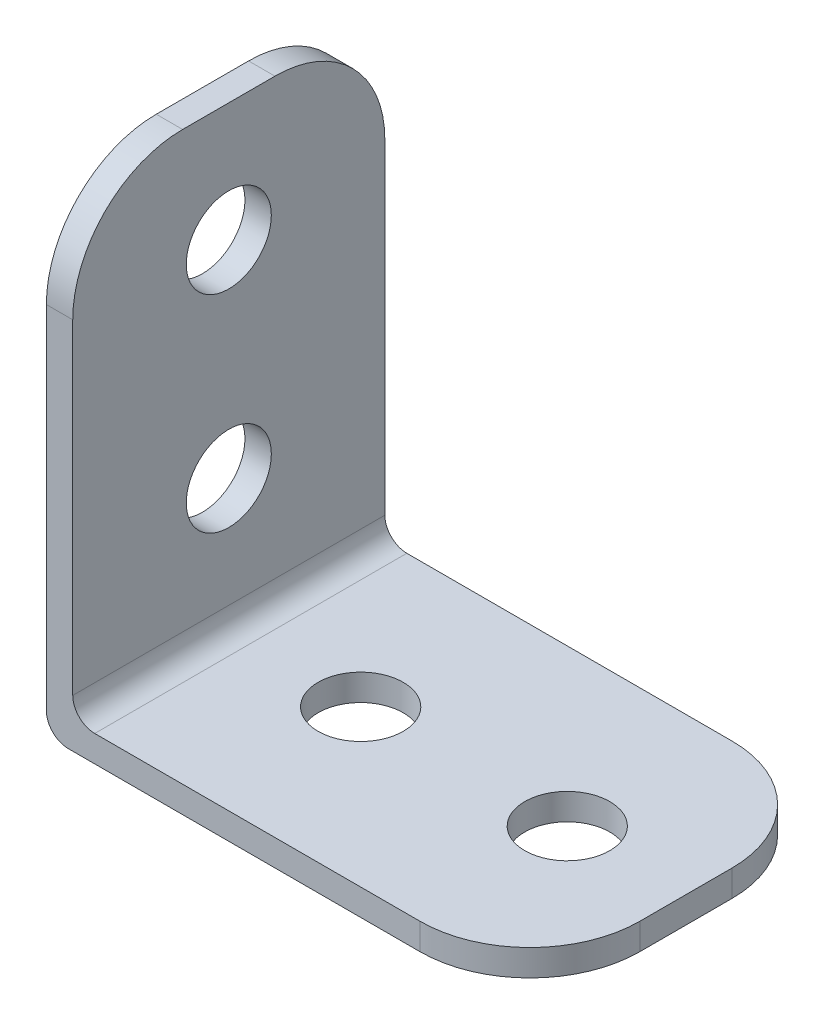
from build123d import *

# Parameters (mm, degrees)
SKETCH1_W                        = 26.416
SKETCH1_H                        = 18.034
BOSS_EXTRUDE2_DEPTH              = 1.524
SKETCH1_4_W                      = 1.524
SKETCH1_4_H                      = 18.034
BOSS_EXTRUDE3_DEPTH              = 27.94
FILLET1_R                        = 1.27
FILLET2_R                        = 6.35
F_10_0_1935_DIAMETER_HOLE1_D     = 4.9149
F_10_0_1935_DIAMETER_HOLE1_DEPTH = 5.08
F_10_0_1935_DIAMETER_HOLE1_TIP   = 1.476584928
F_10_0_1935_DIAMETER_HOLE2_D     = 4.9149
F_10_0_1935_DIAMETER_HOLE2_DEPTH = 5.08
F_10_0_1935_DIAMETER_HOLE2_TIP   = 1.476584928


with BuildPart() as part:
    # Sketch1 → Boss-Extrude2 (new body)
    with BuildSketch(Plane(origin=(0, 0, 0), x_dir=(1, 0, 0), z_dir=(0, 1, 0))):
        with Locations((1.735252818, 0.105208004)):
            Rectangle(SKETCH1_W, SKETCH1_H)
    extrude(amount=BOSS_EXTRUDE2_DEPTH)

    # Sketch1<4> → Boss-Extrude3 (add)
    with BuildSketch(Plane(origin=(0, 0, 0), x_dir=(1, 0, 0), z_dir=(0, 1, 0))):
        with Locations((-12.234747182, 0.105208004)):
            Rectangle(SKETCH1_4_W, SKETCH1_4_H)
    extrude(amount=BOSS_EXTRUDE3_DEPTH)

    # Fillet1
    fillet1_edges = [part.edges().sort_by_distance(p)[0] for p in [
        (-12.996747182, 0, -0.105208004),
        (-11.472747182, 1.524, -0.105208004),
    ]]
    fillet(fillet1_edges, radius=FILLET1_R)

    # Fillet2
    fillet2_edges = [part.edges().sort_by_distance(p)[0] for p in [
        (-12.234747182, 27.94, 8.911791996),
        (-12.234747182, 27.94, -9.122208004),
        (14.943252818, 0.762, -9.122208004),
        (14.943252818, 0.762, 8.911791996),
    ]]
    fillet(fillet2_edges, radius=FILLET2_R)

    # #10 (0.1935) Diameter Hole1
    with Locations(Plane(origin=(0, 1.524, 0), x_dir=(1, 0, 0), z_dir=(0, 1, 0))):
        with Locations((-3.852747182, 0.105208004), (8.085252818, 0.105208004)):
            Hole(F_10_0_1935_DIAMETER_HOLE1_D / 2, depth=F_10_0_1935_DIAMETER_HOLE1_DEPTH)
            with Locations((0, 0, -(F_10_0_1935_DIAMETER_HOLE1_DEPTH + F_10_0_1935_DIAMETER_HOLE1_TIP / 2))):  # 118° drill point
                Cone(0, F_10_0_1935_DIAMETER_HOLE1_D / 2, F_10_0_1935_DIAMETER_HOLE1_TIP, mode=Mode.SUBTRACT)

    # #10 (0.1935) Diameter Hole2
    with Locations(Plane(origin=(-11.472747182, 0, 0), x_dir=(0, 0, -1), z_dir=(1, 0, 0))):
        with Locations((0.105208004, 9.144), (0.105208004, 21.082)):
            Hole(F_10_0_1935_DIAMETER_HOLE2_D / 2, depth=F_10_0_1935_DIAMETER_HOLE2_DEPTH)
            with Locations((0, 0, -(F_10_0_1935_DIAMETER_HOLE2_DEPTH + F_10_0_1935_DIAMETER_HOLE2_TIP / 2))):  # 118° drill point
                Cone(0, F_10_0_1935_DIAMETER_HOLE2_D / 2, F_10_0_1935_DIAMETER_HOLE2_TIP, mode=Mode.SUBTRACT)


solid = part.part
